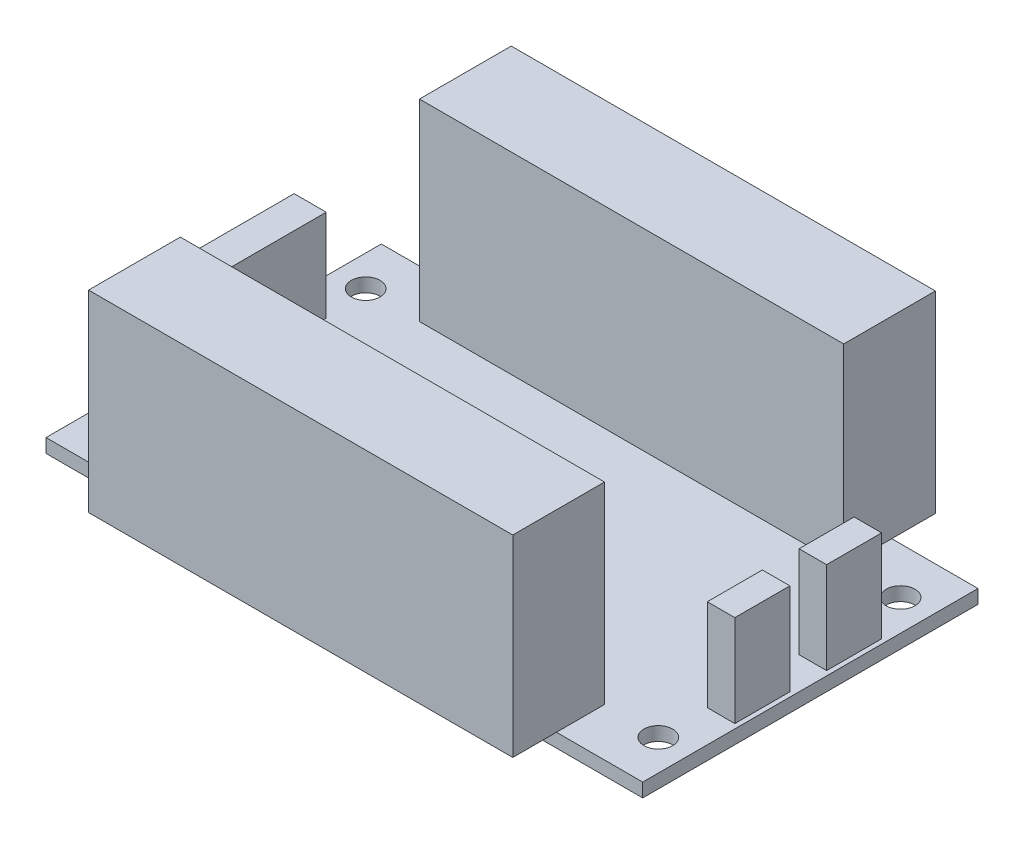
from build123d import *

# Parameters (mm, degrees)
SKETCH1_W           = 65.03
SKETCH1_H           = 36.54
SKETCH1_R           = 1.57
BOSS_EXTRUDE1_DEPTH = 1.5
SKETCH2_W           = 3
SKETCH2_H           = 6
SKETCH2_W_2         = 3.5
SKETCH2_H_2         = 16
BOSS_EXTRUDE2_DEPTH = 10
SKETCH3_W           = 46.23
SKETCH3_H           = 10
BOSS_EXTRUDE3_DEPTH = 21


with BuildPart() as part:
    # Sketch1 → Boss-Extrude1 (new body)
    with BuildSketch(Plane(origin=(0, 0, 0), x_dir=(1, 0, 0), z_dir=(0, 1, 0))):
        Rectangle(SKETCH1_W, SKETCH1_H)
        with Locations(Location((-29.145, 13.2, 0), (0, 0, 270))):
            Circle(SKETCH1_R, mode=Mode.SUBTRACT)
        with Locations(Location((29.145, 13.2, 0), (0, 0, 90))):
            Circle(SKETCH1_R, mode=Mode.SUBTRACT)
        with Locations(Location((29.145, -13.2, 0), (0, 0, 270))):
            Circle(SKETCH1_R, mode=Mode.SUBTRACT)
        with Locations(Location((-29.145, -13.2, 0), (0, 0, 90))):
            Circle(SKETCH1_R, mode=Mode.SUBTRACT)
    extrude(amount=BOSS_EXTRUDE1_DEPTH)

    # Sketch2 → Boss-Extrude2 (add)
    with BuildSketch(Plane(origin=(0, 1.5, 0), x_dir=(1, 0, 0), z_dir=(0, 1, 0))):
        with Locations((30.515, -4.73)):
            Rectangle(SKETCH2_W, SKETCH2_H)
        with Locations((-30.265, 0.27)):
            Rectangle(SKETCH2_W_2, SKETCH2_H_2)
        with Locations((30.515, 5.27)):
            Rectangle(SKETCH2_W, SKETCH2_H)
    extrude(amount=BOSS_EXTRUDE2_DEPTH)

    # Sketch3 → Boss-Extrude3 (add)
    with BuildSketch(Plane(origin=(0, 1.5, 0), x_dir=(1, 0, 0), z_dir=(0, 1, 0))):
        with Locations((0, -18.030936004)):
            Rectangle(SKETCH3_W, SKETCH3_H)
        with Locations((0, 18.030936004)):
            Rectangle(SKETCH3_W, SKETCH3_H)
    extrude(amount=BOSS_EXTRUDE3_DEPTH)


solid = part.part
